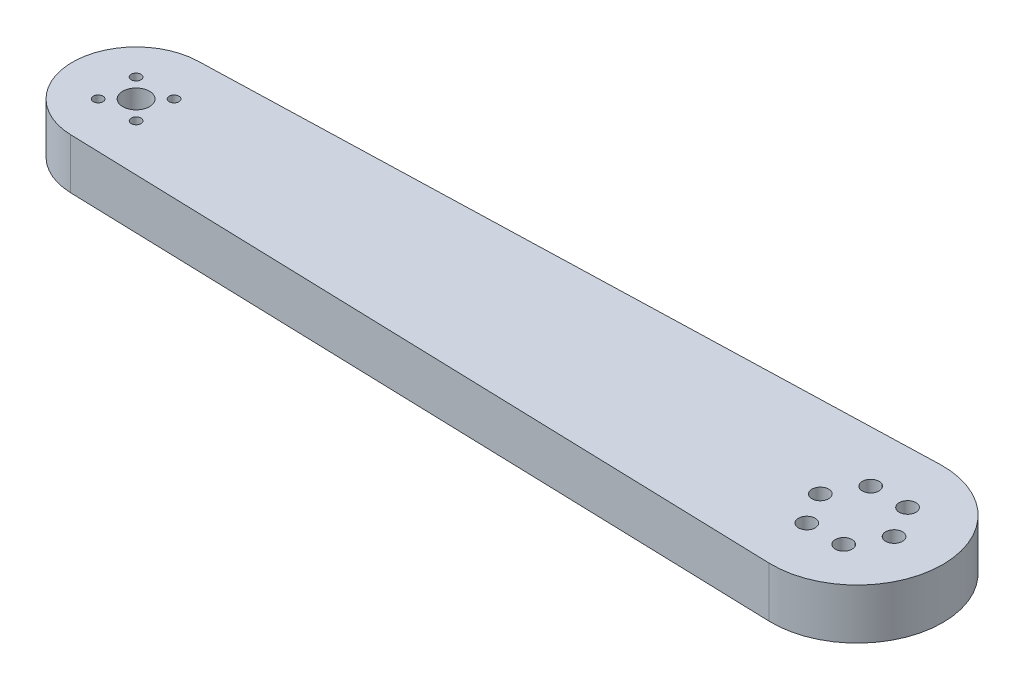
from build123d import *

# Parameters (mm, degrees)
SKETCH_1_R      = 4
SKETCH_1_R_2    = 2.5
SKETCH_1_R_3    = 1.45
EXTRUDE_1_DEPTH = 15
CHAMFER_1_SIZE  = 1.8
CHAMFER_2_SIZE  = 2.7


with BuildPart() as part:
    # 草图1 → 凸台-拉伸1 (new body)
    with BuildSketch(Plane(origin=(0, 0, 0), x_dir=(1, 0, 0), z_dir=(0, 1, 0))):
        with BuildLine():
            Line((-0.574418605, 18.991314943), (214.229069767, 25.488343739))
            ThreePointArc((214.229069767, 25.488343739), (240.5, 0), (214.229069767, -25.488343739))
            Line((214.229069767, -25.488343739), (-0.574418605, -18.991314943))
            ThreePointArc((-0.574418605, -18.991314943), (-19, 0), (-0.574418605, 18.991314943))
        make_face()
        with Locations(Location((0, 0, 0), (0, 0, 270))):
            Circle(SKETCH_1_R, mode=Mode.SUBTRACT)
        with Locations(Location((209.5, 9.526279442, 0), (0, 0, 270))):
            Circle(SKETCH_1_R_2, mode=Mode.SUBTRACT)
        with Locations(Location((220.5, 9.526279442, 0), (0, 0, 270))):
            Circle(SKETCH_1_R_2, mode=Mode.SUBTRACT)
        with Locations(Location((226, 0, 0), (0, 0, 270))):
            Circle(SKETCH_1_R_2, mode=Mode.SUBTRACT)
        with Locations(Location((220.5, -9.526279442, 0), (0, 0, 270))):
            Circle(SKETCH_1_R_2, mode=Mode.SUBTRACT)
        with Locations(Location((209.5, -9.526279442, 0), (0, 0, 270))):
            Circle(SKETCH_1_R_2, mode=Mode.SUBTRACT)
        with Locations(Location((204, 0, 0), (0, 0, 270))):
            Circle(SKETCH_1_R_2, mode=Mode.SUBTRACT)
        with Locations(Location((-5.656854249, 5.656854249, 0), (0, 0, 270))):
            Circle(SKETCH_1_R_3, mode=Mode.SUBTRACT)
        with Locations(Location((5.656854249, 5.656854249, 0), (0, 0, 270))):
            Circle(SKETCH_1_R_3, mode=Mode.SUBTRACT)
        with Locations(Location((5.656854249, -5.656854249, 0), (0, 0, 270))):
            Circle(SKETCH_1_R_3, mode=Mode.SUBTRACT)
        with Locations(Location((-5.656854249, -5.656854249, 0), (0, 0, 270))):
            Circle(SKETCH_1_R_3, mode=Mode.SUBTRACT)
    extrude(amount=EXTRUDE_1_DEPTH)

    # 倒角1
    chamfer_1_edges = [part.edges().sort_by_distance(p)[0] for p in [
        (5.656854249, 0, -7.106854249),
        (-5.656854249, 0, -7.106854249),
        (5.656854249, 0, 4.206854249),
        (-5.656854249, 0, 4.206854249),
    ]]
    chamfer(chamfer_1_edges, length=CHAMFER_1_SIZE)

    # 倒角2
    chamfer_2_edges = [part.edges().sort_by_distance(p)[0] for p in [
        (209.5, 0, -12.026279442),
        (226, 0, -2.5),
        (209.5, 0, 7.026279442),
    ]]
    chamfer(chamfer_2_edges, length=CHAMFER_2_SIZE)


solid = part.part
